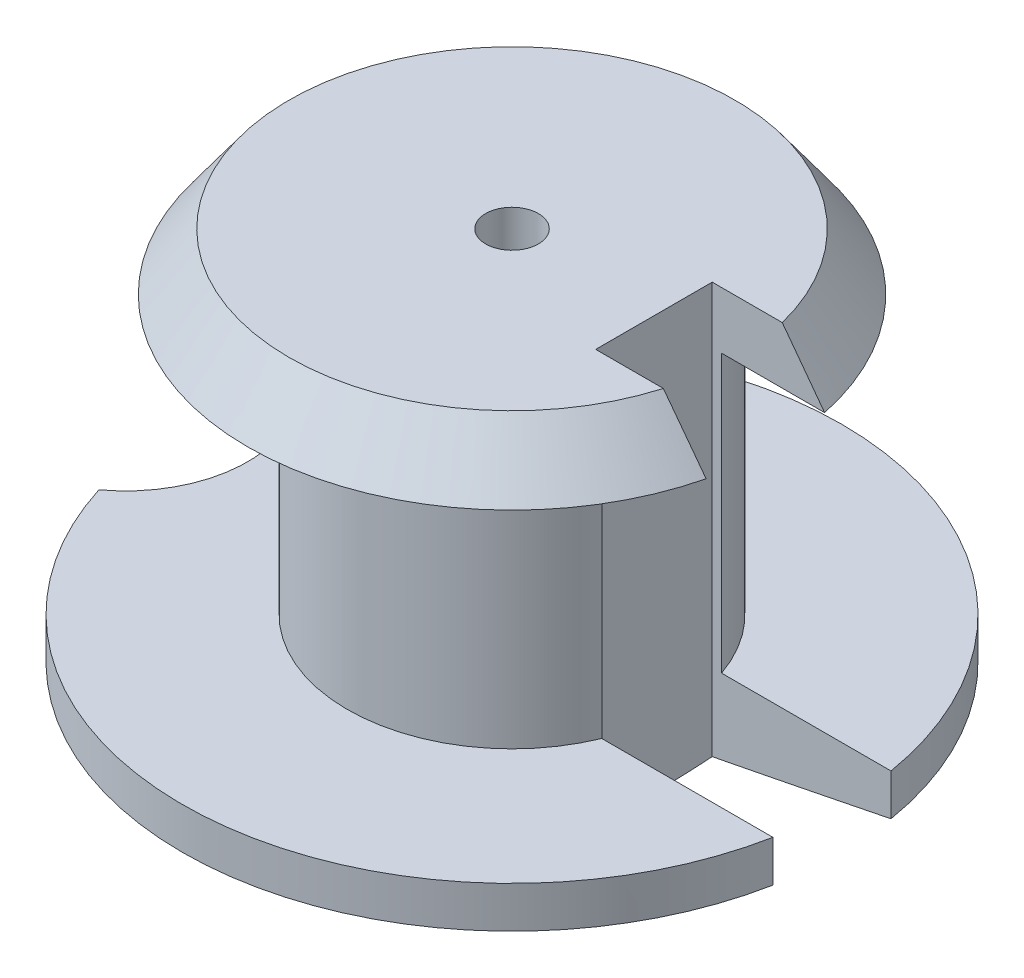
from build123d import *

# Parameters (mm, degrees)
ESQUISSE2_R             = 25.041983138
ESQUISSE2_W             = 44.202160672
ESQUISSE2_H             = 23.897916136
ENL_V_MAT_EXTRU_1_DEPTH = 90


with BuildPart() as part:
    # Esquisse1 → Révolution1 (revolve)
    with BuildSketch(Plane.XY, mode=Mode.PRIVATE) as r_volution1_sk:
        Polygon((-45.722988866, 74.192857143), (-5.408703152, 74.192857143), (-5.408703152, 60.592857143), (0, 60.592857143), (0, -16.635714286), (-67.580131723, -2.792857143), (-67.580131723, 5.707142857), (-33.790065862, 5.707142857), (-33.790065862, 62.535714286), (-54.198475628, 62.535714286), align=None)
    revolve(r_volution1_sk.sketch.rotate(Axis((0, 60.592857143, 0), (0, -1, 0)), 270), axis=Axis((0, 60.592857143, 0), (0, -1, 0)))

    # Esquisse2 → Enlèv. mat.-Extru.1 (cut)
    with BuildSketch(Plane(origin=(0, 74.192857143, 0), x_dir=(1, 0, 0), z_dir=(0, 1, 0))):
        with Locations((-79.240458765, 0)):
            Circle(ESQUISSE2_R)
        with Locations((52.10823819, -0.8984179)):
            Rectangle(ESQUISSE2_W, ESQUISSE2_H)
    extrude(amount=-ENL_V_MAT_EXTRU_1_DEPTH, mode=Mode.SUBTRACT)


solid = part.part
